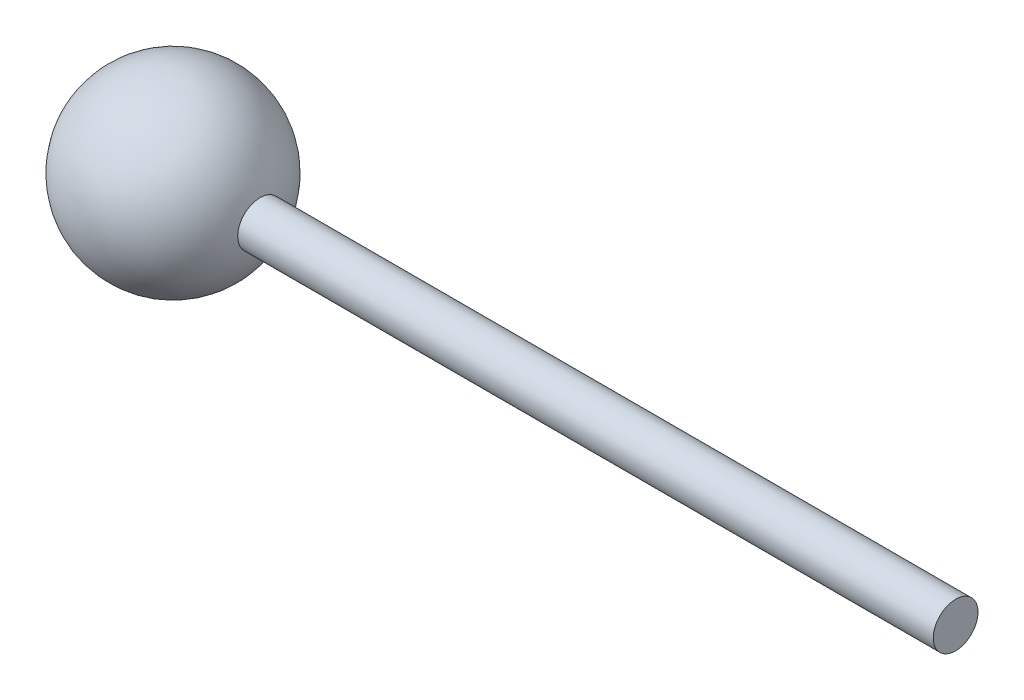
from build123d import *

# Parameters (mm, degrees)
SKETCH1_R      = 1.27
EXTRUDE1_DEPTH = 22.225


with BuildPart() as part:
    # Sketch1 → Extrude1 (new, symmetric)
    with BuildSketch(Plane(origin=(0, 0, 0), x_dir=(0, 0, -1), z_dir=(1, 0, 0))):
        Circle(SKETCH1_R)
    extrude(amount=EXTRUDE1_DEPTH, both=True)

    # Sketch2 → Revolve1 (revolve)
    with BuildSketch(Plane.ZY.offset(22.225)):
        with BuildLine():
            Line((0, -5.1054), (0, 5.1054))
            ThreePointArc((0, 5.1054), (-5.1054, 0), (0, -5.1054))
        make_face()
    revolve(axis=Axis((-22.225, 8.762723072, 0), (0, -1, 0)))


solid = part.part
